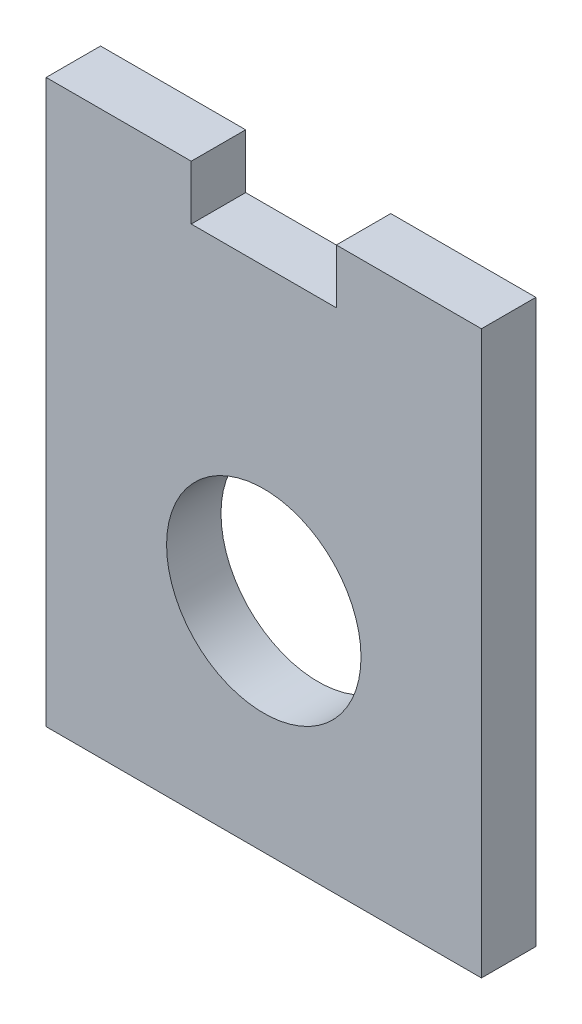
from build123d import *

# Parameters (mm, degrees)
SKETCH1_R           = 8.509
BOSS_EXTRUDE1_DEPTH = 4.7625


with BuildPart() as part:
    # Sketch1 → Boss-Extrude1 (new body)
    with BuildSketch(Plane.XY):
        Polygon((0, 0), (0, 49.2125), (12.7, 49.2125), (12.7, 44.45), (25.4, 44.45), (25.4, 49.2125), (38.1, 49.2125), (38.1, 0), align=None)
        with Locations(Location((19.05, 19.05, 0), (0, 0, 180))):
            Circle(SKETCH1_R, mode=Mode.SUBTRACT)
    extrude(amount=BOSS_EXTRUDE1_DEPTH)


solid = part.part
